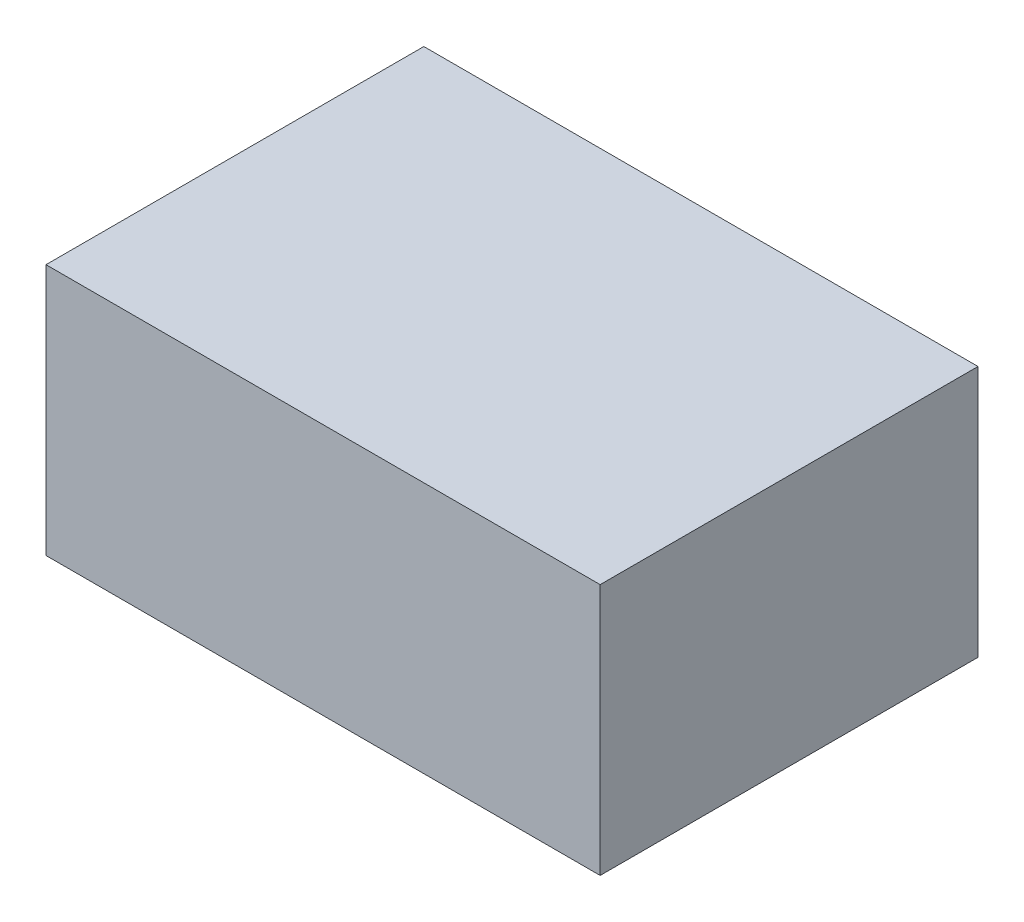
from build123d import *

# Parameters (mm, degrees)
SKETCH1_W           = 220
SKETCH1_H           = 150
BOSS_EXTRUDE1_DEPTH = 100


with BuildPart() as part:
    # Sketch1 → Boss-Extrude1 (new body)
    with BuildSketch(Plane(origin=(0, 0, 0), x_dir=(1, 0, 0), z_dir=(0, 1, 0))):
        Rectangle(SKETCH1_W, SKETCH1_H)
    extrude(amount=BOSS_EXTRUDE1_DEPTH)


solid = part.part
